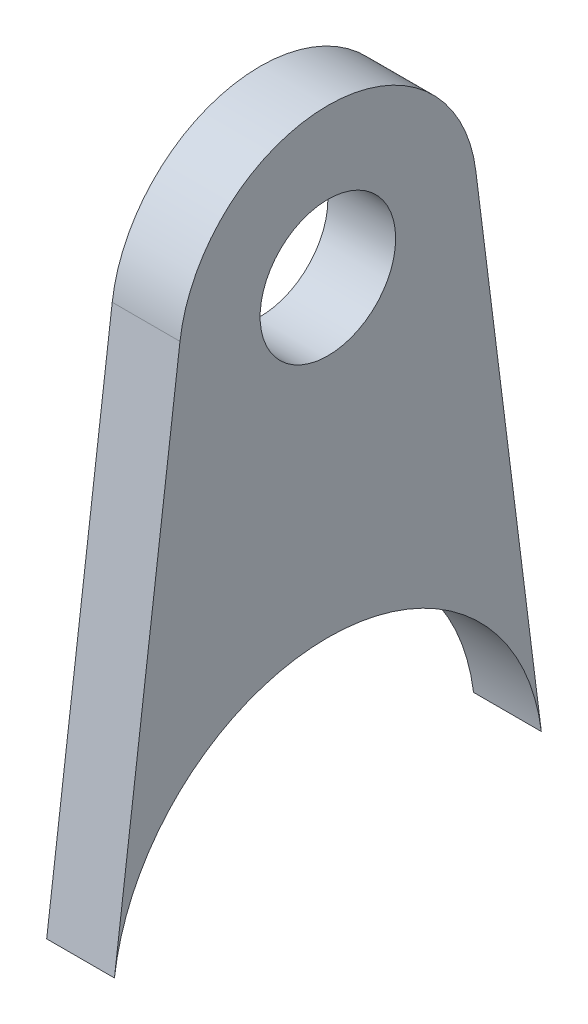
from build123d import *

# Parameters (mm, degrees)
SKETCH2_R           = 5
BOSS_EXTRUDE1_DEPTH = 2.5


with BuildPart() as part:
    # Sketch2 → Boss-Extrude1 (new, symmetric)
    with BuildSketch(Plane(origin=(0, 0, 0), x_dir=(0, 0, -1), z_dir=(1, 0, 0))):
        with BuildLine():
            Line((-10.913166227, 40.254421222), (-15.749683077, 1.990755627))
            ThreePointArc((-15.749683077, 1.990755627), (0, 15.875), (15.749683077, 1.990755627))
            Line((15.749683077, 1.990755627), (10.913166227, 40.254421222))
            ThreePointArc((10.913166227, 40.254421222), (0, 49.875), (-10.913166227, 40.254421222))
        make_face()
        with Locations((0, 38.875)):
            Circle(SKETCH2_R, mode=Mode.SUBTRACT)
    extrude(amount=BOSS_EXTRUDE1_DEPTH, both=True)


solid = part.part
